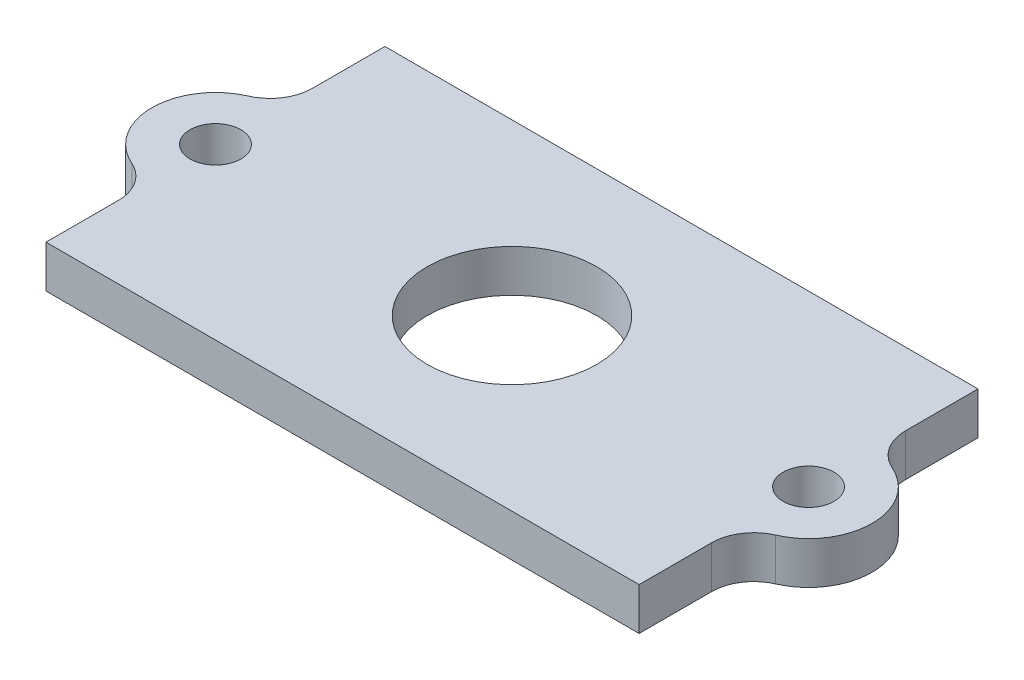
from build123d import *

# Parameters (mm, degrees)
EXTRUDE1_DEPTH      = 4
EXTRUDE2_DEPTH      = 12.357816692
EXTRUDE2_DEPTH_BACK = 12.357816692
SKETCH2_R           = 1
EXTRUDE3_DEPTH      = 12.357816692
EXTRUDE3_DEPTH_BACK = 12.357816692
FILLET2_R           = 1
EXTRUDE4_DEPTH      = 14
EXTRUDE4_DEPTH_BACK = 3
SKETCH5_W           = 0.95644391
SKETCH5_H           = 3.560686456
EXTRUDE5_DEPTH      = 9
EXTRUDE6_DEPTH      = 1
SKETCH7_R           = 0.6
EXTRUDE7_DEPTH      = 1
FILLET3_R           = 1
SKETCH8_R           = 2
EXTRUDE8_DEPTH      = 1
SKETCH9_R           = 15.158662045
EXTRUDE9_DEPTH      = 18.811513131


with BuildPart() as part:
    # Sketch1 → Extrude1 (new, symmetric)
    with BuildSketch(Plane.XY):
        Polygon((0, 0), (-7, 0), (-7, 8), (7, 8), (7, 0), align=None)
    extrude(amount=EXTRUDE1_DEPTH, both=True)

    # Sketch2 → Extrude2 (cut, two sides: drawn at the far end of the back side and taken through both)
    with BuildSketch(Plane.XY.offset(-EXTRUDE2_DEPTH_BACK)):
        with Locations((4.5, 5.5)):
            Circle(SKETCH2_R)
    extrude(amount=EXTRUDE2_DEPTH + EXTRUDE2_DEPTH_BACK, mode=Mode.SUBTRACT)

    # Sketch4 → Extrude3 (cut, two sides: drawn at the far end of the back side and taken through both)
    with BuildSketch(Plane(origin=(0, 0, 0), x_dir=(0, 0, -1), z_dir=(1, 0, 0)).offset(-EXTRUDE3_DEPTH_BACK)):
        Polygon((0, 1), (3, 1), (3, 9.732029078), (-3, 9.732029078), (-3, 1), align=None)
    extrude(amount=EXTRUDE3_DEPTH + EXTRUDE3_DEPTH_BACK, mode=Mode.SUBTRACT)

    # Fillet2
    fillet2_edges = [part.edges().sort_by_distance(p)[0] for p in [
        (7, 8, -3.5),
        (7, 8, 3.5),
        (-7, 8, -3.5),
        (-7, 8, 3.5),
    ]]
    fillet(fillet2_edges, radius=FILLET2_R)

    # Sketch3 → Extrude4 (add, two sides: drawn at the far end of the back side and taken through both)
    with BuildSketch(Plane.XY.offset(-EXTRUDE4_DEPTH_BACK)):
        with BuildLine():
            ThreePointArc((-3, 6), (-4.060660172, 3.439339828), (-1.5, 4.5))
            ThreePointArc((-1.5, 4.5), (-1.939339828, 5.560660172), (-3, 6))
        make_face()
    extrude(amount=EXTRUDE4_DEPTH + EXTRUDE4_DEPTH_BACK)

    # Sketch5 → Extrude5 (cut)
    with BuildSketch(Plane.XY.offset(14)):
        with Locations((-4.478221955, 4.280343228)):
            Rectangle(SKETCH5_W, SKETCH5_H)
    extrude(amount=-EXTRUDE5_DEPTH, mode=Mode.SUBTRACT)

    # Sketch6 → Extrude6 (add)
    with BuildSketch(Plane.XZ):
        with BuildLine():
            ThreePointArc((-5.910714286, -1.031240337), (-6, 0), (-5.910714286, 1.031240337))
            ThreePointArc((-5.910714286, 1.031240337), (-8.5, 0), (-5.910714286, -1.031240337))
        make_face()
        with BuildLine():
            ThreePointArc((7, -1.5), (8.5, 0), (7, 1.5))
            Line((7, 1.5), (7, -1.5))
        make_face()
    extrude(amount=-EXTRUDE6_DEPTH)

    # Sketch7 → Extrude7 (cut)
    with BuildSketch(Plane.XZ):
        with Locations((-7, 0)):
            Circle(SKETCH7_R)
        with Locations((7, 0)):
            Circle(SKETCH7_R)
    extrude(amount=-EXTRUDE7_DEPTH, mode=Mode.SUBTRACT)

    # Fillet3
    fillet3_edges = [part.edges().sort_by_distance(p)[0] for p in [
        (7, 0.5, -1.5),
        (7, 0.5, 1.5),
        (-7, 0.5, -1.5),
        (-7, 0.5, 1.5),
    ]]
    fillet(fillet3_edges, radius=FILLET3_R)

    # Sketch8 → Extrude8 (cut)
    with BuildSketch(Plane.XZ):
        Circle(SKETCH8_R)
    extrude(amount=-EXTRUDE8_DEPTH, mode=Mode.SUBTRACT)

    # Sketch9 → Extrude9 (cut, through all)
    with BuildSketch(Plane(origin=(0, 1, 0), x_dir=(1, 0, 0), z_dir=(0, 1, 0))):
        Circle(SKETCH9_R)
    extrude(amount=EXTRUDE9_DEPTH, mode=Mode.SUBTRACT)


solid = part.part
